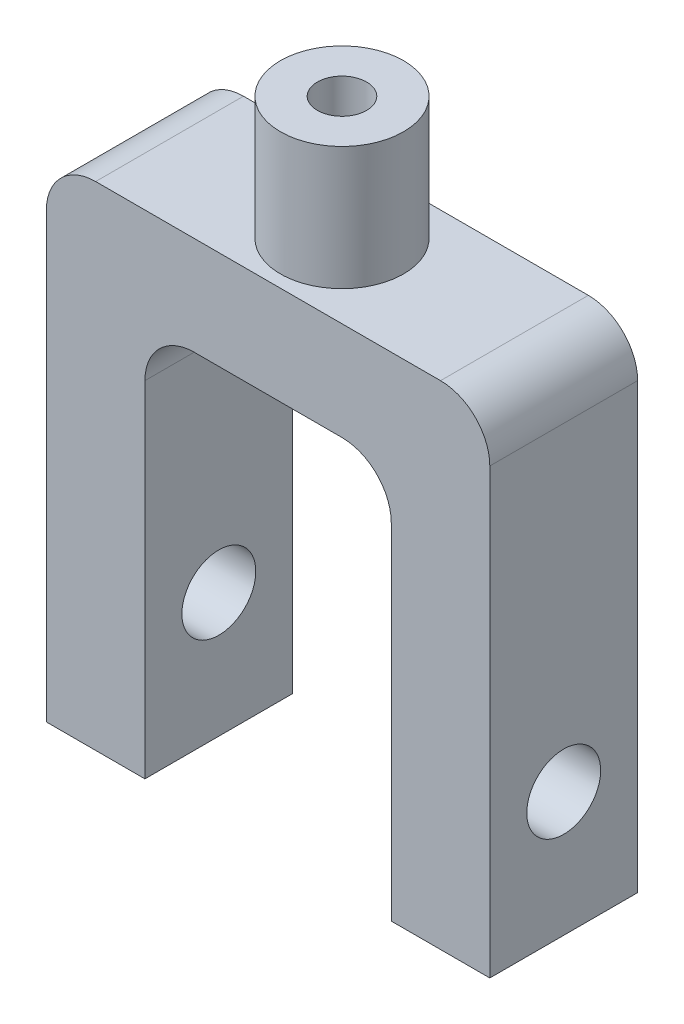
from build123d import *

# Parameters (mm, degrees)
BOSS_EXTRUDE1_DEPTH = 30
FILLET1_R           = 10
SKETCH2_R           = 7.5
CUT_EXTRUDE1_DEPTH  = 138.840487521
SKETCH3_R           = 12.5
SKETCH3_R_2         = 5
BOSS_EXTRUDE2_DEPTH = 25


with BuildPart() as part:
    # Sketch1 → Boss-Extrude1 (new body)
    with BuildSketch(Plane.XY):
        Polygon((0, 0), (0, 100), (90, 100), (90, 0), (70, 0), (70, 80), (20, 80), (20, 0), align=None)
    extrude(amount=BOSS_EXTRUDE1_DEPTH)

    # Fillet1
    fillet1_edges = [part.edges().sort_by_distance(p)[0] for p in [
        (0, 100, 15),
        (90, 100, 15),
        (70, 80, 15),
        (20, 80, 15),
    ]]
    fillet(fillet1_edges, radius=FILLET1_R)

    # Sketch2 → Cut-Extrude1 (cut, through all)
    with BuildSketch(Plane(origin=(90, 0, 0), x_dir=(0, 0, -1), z_dir=(1, 0, 0))):
        with Locations(Location((-15, 25.249892163, 0), (0, 0, 90))):
            Circle(SKETCH2_R)
    extrude(amount=-CUT_EXTRUDE1_DEPTH, mode=Mode.SUBTRACT)

    # Sketch3 → Boss-Extrude2 (add)
    with BuildSketch(Plane(origin=(0, 100, 0), x_dir=(1, 0, 0), z_dir=(0, 1, 0))):
        with Locations(Location((45, -15, 0), (0, 0, 90))):
            Circle(SKETCH3_R)
        with Locations(Location((45, -15, 0), (0, 0, 270))):
            Circle(SKETCH3_R_2, mode=Mode.SUBTRACT)
    extrude(amount=BOSS_EXTRUDE2_DEPTH)


solid = part.part
